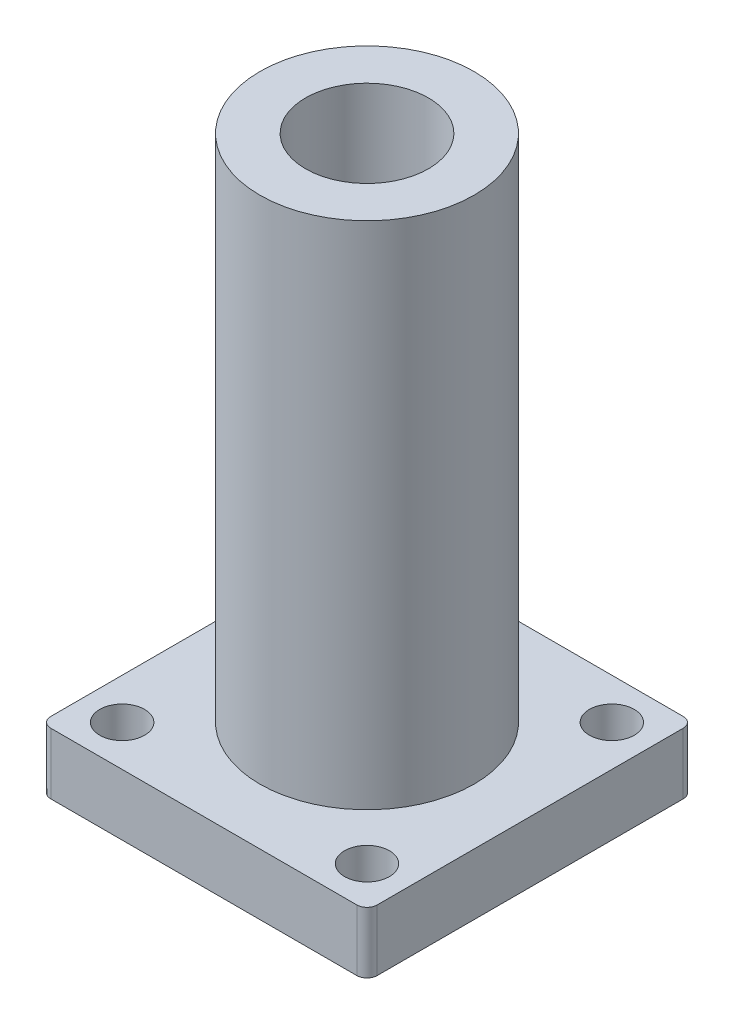
from build123d import *

# Parameters (mm, degrees)
SKETCH1_W                      = 32
SKETCH1_H                      = 32
BOSS_EXTRUDE1_DEPTH            = 6
SKETCH2_W                      = 10.5
SKETCH2_H                      = 50
F_4_4_4_4_DIAMETER_HOLE1_D     = 4.4
F_4_4_4_4_DIAMETER_HOLE1_DEPTH = 56
HOLE1_D                        = 12.05
FILLET1_R                      = 1


with BuildPart() as part:
    # Sketch1 → Boss-Extrude1 (new body)
    with BuildSketch(Plane.XZ):
        with Locations((16, -16)):
            Rectangle(SKETCH1_W, SKETCH1_H)
    extrude(amount=-BOSS_EXTRUDE1_DEPTH)

    # Sketch2 → Revolve1 (revolve)
    with BuildSketch(Plane(origin=(0, 0, -16.000000238), x_dir=(-1, 0, 0), z_dir=(0, 0, -1)), mode=Mode.PRIVATE) as revolve1_sk:
        with Locations((-21.250000238, 31)):
            Rectangle(SKETCH2_W, SKETCH2_H)
    revolve(revolve1_sk.sketch.rotate(Axis((16.000000238, 6, -16.000000238), (0, 1, 0)), 270), axis=Axis((16.000000238, 6, -16.000000238), (0, 1, 0)))

    # Ø4.4 (4.4) Diameter Hole1
    with Locations(Plane(origin=(0, 0, 0), x_dir=(-1, 0, 0), z_dir=(0, -1, 0))):
        with Locations((-28, 4), (-28, 28), (-4.00000006, 4.00000006), (-4.00000006, 28.000000417)):
            Hole(F_4_4_4_4_DIAMETER_HOLE1_D / 2, depth=F_4_4_4_4_DIAMETER_HOLE1_DEPTH)

    # Hole1 (through all)
    with Locations(Plane(origin=(0, 56, 0), x_dir=(1, 0, 0), z_dir=(0, 1, 0))):
        with Locations((16.000000238, 16.000000238)):
            Hole(HOLE1_D / 2)

    # Fillet1
    fillet1_edges = [part.edges().sort_by_distance(p)[0] for p in [
        (0, 3, -32),
        (0, 3, 0),
        (32, 3, 0),
        (32, 3, -32),
    ]]
    fillet(fillet1_edges, radius=FILLET1_R)


solid = part.part
